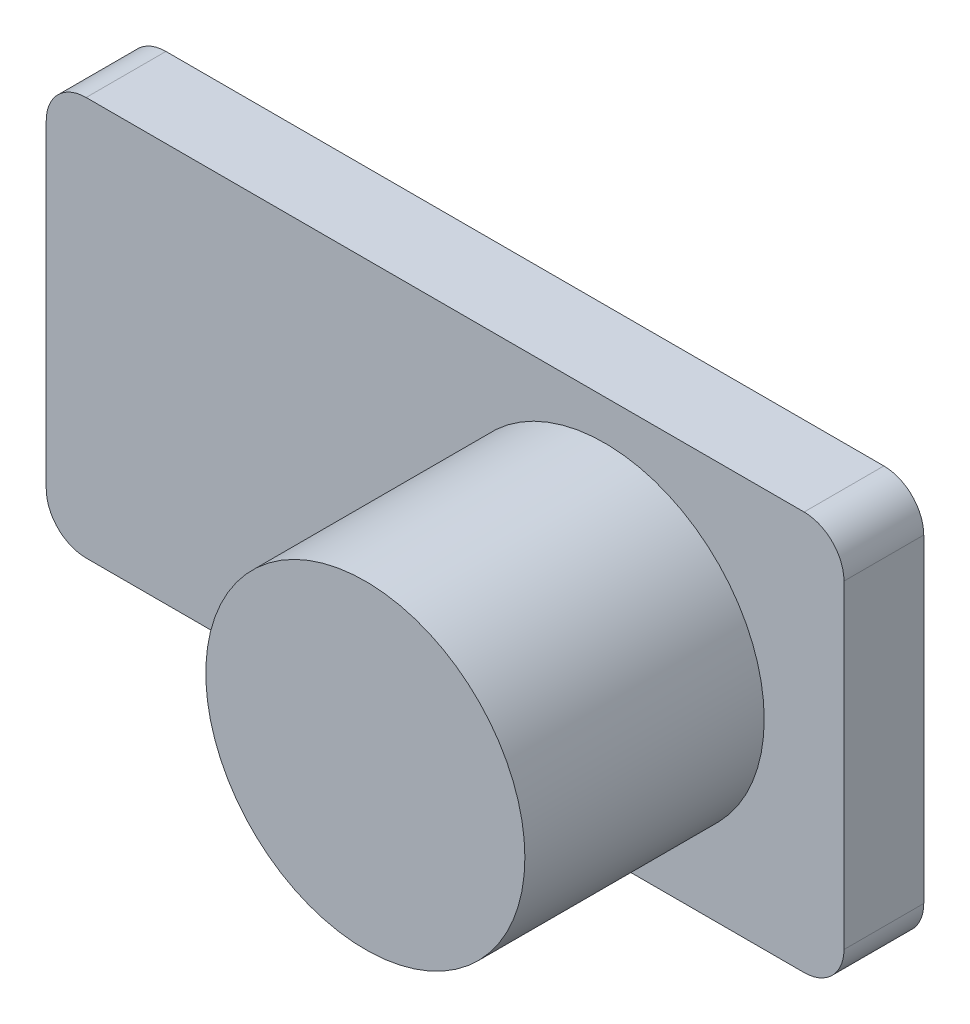
from build123d import *

# Parameters (mm, degrees)
SKETCH1_W           = 20
SKETCH1_H           = 10
BOSS_EXTRUDE1_DEPTH = 2
SKETCH2_R           = 4
BOSS_EXTRUDE2_DEPTH = 6
FILLET1_R           = 1


with BuildPart() as part:
    # Sketch1 → Boss-Extrude1 (new body)
    with BuildSketch(Plane.XY):
        with Locations((0, -27.096458497)):
            Rectangle(SKETCH1_W, SKETCH1_H)
    extrude(amount=BOSS_EXTRUDE1_DEPTH)

    # Sketch2 → Boss-Extrude2 (add)
    with BuildSketch(Plane.XY.offset(2)):
        with Locations((4, -27.096458497)):
            Circle(SKETCH2_R)
    extrude(amount=BOSS_EXTRUDE2_DEPTH)

    # Fillet1
    fillet1_edges = [part.edges().sort_by_distance(p)[0] for p in [
        (-10, -22.096458497, 1),
        (10, -22.096458497, 1),
        (10, -32.096458497, 1),
        (-10, -32.096458497, 1),
    ]]
    fillet(fillet1_edges, radius=FILLET1_R)


solid = part.part
